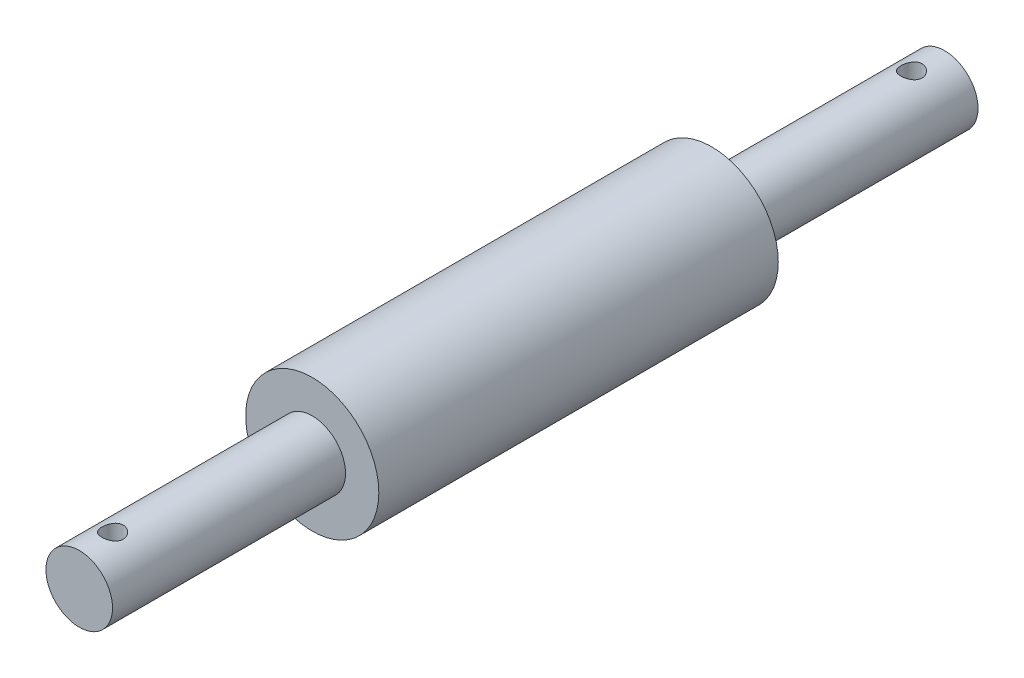
from build123d import *

# Parameters (mm, degrees)
SKETCH_1_R               = 5
EXTRUDE_1_DEPTH          = 130
EXTRUDE_START            = -35
SKETCH_2_R               = 10
EXTRUDE_2_DEPTH          = 60
CUT_EXTRUDE_1_DEPTH      = 131.766968306
CUT_EXTRUDE_1_DEPTH_BACK = 131.766968306
SKETCH_3_R               = 1.6


with BuildPart() as part:
    # 草图1 → 凸台-拉伸1 (new body)
    with BuildSketch(Plane.XY):
        Circle(SKETCH_1_R)
    extrude(amount=EXTRUDE_1_DEPTH)

    # 草图2 → 凸台-拉伸2 (add)
    with BuildSketch(Plane.XY.offset(130).offset(EXTRUDE_START)):
        Circle(SKETCH_2_R)
    extrude(amount=-EXTRUDE_2_DEPTH)

    # 草图3 → 切除-拉伸1 (cut, two sides: drawn at the far end of the back side and taken through both)
    with BuildSketch(Plane(origin=(0, 0, 0), x_dir=(1, 0, 0), z_dir=(0, 1, 0)).offset(-CUT_EXTRUDE_1_DEPTH_BACK)):
        with Locations(Location((0, -125, 0), (0, 0, 270))):
            Circle(SKETCH_3_R)
        with Locations(Location((0, -5, 0), (0, 0, 270))):
            Circle(SKETCH_3_R)
    extrude(amount=CUT_EXTRUDE_1_DEPTH + CUT_EXTRUDE_1_DEPTH_BACK, mode=Mode.SUBTRACT)


solid = part.part
